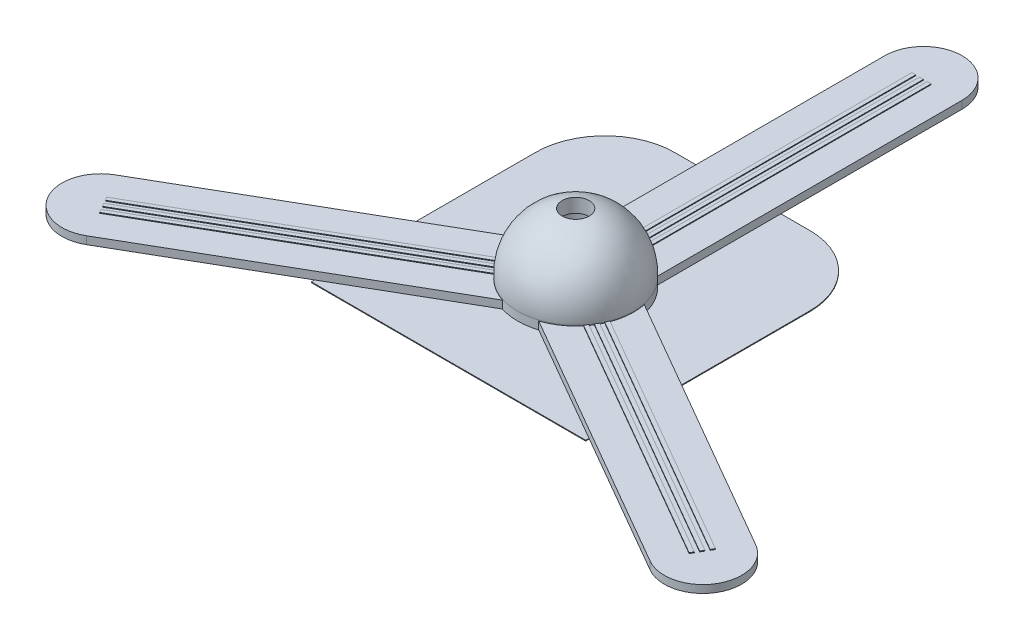
from build123d import *

# Parameters (mm, degrees)
BOSS_EXTRUDE1_DEPTH = 1
SKETCH2_R           = 7.5
BOSS_EXTRUDE2_DEPTH = 0.1
DOME1_FACE_RADIUS   = 7.5
DOME1_HEIGHT        = 8
SKETCH3_R           = 1.75
CUT_EXTRUDE1_DEPTH  = 68.203209981
SKETCH5_R           = 2.75
CUT_EXTRUDE2_DEPTH  = 7.1
SKETCH6_W           = 0.5
SKETCH6_H           = 38.067336288
BOSS_EXTRUDE3_DEPTH = 0.1
BOSS_EXTRUDE6_DEPTH = 0.1


with BuildPart() as part:
    # Sketch1 → Boss-Extrude1 (new body)
    with BuildSketch(Plane(origin=(0, 0, 0), x_dir=(1, 0, 0), z_dir=(0, 1, 0))):
        with BuildLine():
            Line((-5, 45), (-5, 5.590169944))
            ThreePointArc((-5, 5.590169944), (-6.495190528, 3.75), (-7.341229183, 1.535042047))
            Line((-7.341229183, 1.535042047), (-41.47114317, -18.169872981))
            ThreePointArc((-41.47114317, -18.169872981), (-43.301270189, -25), (-36.47114317, -26.830127019))
            Line((-36.47114317, -26.830127019), (-2.341229183, -7.125211991))
            ThreePointArc((-2.341229183, -7.125211991), (0, -7.5), (2.341229183, -7.125211991))
            Line((2.341229183, -7.125211991), (36.47114317, -26.830127019))
            ThreePointArc((36.47114317, -26.830127019), (43.301270189, -25), (41.47114317, -18.169872981))
            Line((41.47114317, -18.169872981), (7.341229183, 1.535042047))
            ThreePointArc((7.341229183, 1.535042047), (6.495190528, 3.75), (5, 5.590169944))
            Line((5, 5.590169944), (5, 45))
            ThreePointArc((5, 45), (0, 50), (-5, 45))
        make_face()
    extrude(amount=BOSS_EXTRUDE1_DEPTH)

    # Sketch2 → Boss-Extrude2 (add)
    with BuildSketch(Plane(origin=(0, 1, 0), x_dir=(1, 0, 0), z_dir=(0, 1, 0))):
        with Locations(Location((0, 0, 0), (0, 0, 48.189685104))):
            Circle(SKETCH2_R)
    extrude(amount=BOSS_EXTRUDE2_DEPTH)

    # Dome1: a dome of height H over a round flat face of radius A is a cap of a sphere of radius (A * A + H * H) / (2 * H)
    dome1_r = (DOME1_FACE_RADIUS * DOME1_FACE_RADIUS + DOME1_HEIGHT * DOME1_HEIGHT) / (2 * DOME1_HEIGHT)
    dome1_base = Plane((0, 1.1, 0), z_dir=(0, 1, 0))
    with Locations(dome1_base.offset(DOME1_HEIGHT - dome1_r)):
        dome1_ball = Sphere(dome1_r, mode=Mode.PRIVATE)
    add(split(dome1_ball, bisect_by=dome1_base, keep=Keep.TOP, mode=Mode.PRIVATE))

    # Sketch3 → Cut-Extrude1 (cut, through all)
    with BuildSketch(Plane.XZ):
        with Locations(Location((0, 0, 0), (0, 0, 270))):
            Circle(SKETCH3_R)
    extrude(amount=-CUT_EXTRUDE1_DEPTH, mode=Mode.SUBTRACT)

    # Sketch5 → Cut-Extrude2 (cut)
    with BuildSketch(Plane.XZ):
        with Locations(Location((0, 0, 0), (0, 0, 270))):
            Circle(SKETCH5_R)
    extrude(amount=-CUT_EXTRUDE2_DEPTH, mode=Mode.SUBTRACT)

    # Sketch6 → Boss-Extrude3 (add)
    with BuildSketch(Plane(origin=(0, 1, 0), x_dir=(1, 0, 0), z_dir=(0, 1, 0))):
        with Locations((-1, 25.721859363)):
            Rectangle(SKETCH6_W, SKETCH6_H)
        with Locations((0, 25.721859363)):
            Rectangle(SKETCH6_W, SKETCH6_H)
        with Locations((1, 25.721859363)):
            Rectangle(SKETCH6_W, SKETCH6_H)
        Polygon((39.384423781, -21.295231999), (6.417143501, -2.261563855), (6.167143501, -2.694576557), (39.134423781, -21.728244701), align=None)
        Polygon((38.884423781, -22.161257403), (5.917143501, -3.127589259), (5.667143501, -3.560601961), (38.634423781, -22.594270105), align=None)
        Polygon((38.384423781, -23.027282807), (5.417143501, -3.993614663), (5.167143501, -4.426627364), (38.134423781, -23.460295508), align=None)
        Polygon((-38.134423781, -23.460295508), (-5.167143501, -4.426627364), (-5.417143501, -3.993614663), (-38.384423781, -23.027282807), align=None)
        Polygon((-38.634423781, -22.594270105), (-5.667143501, -3.560601961), (-5.917143501, -3.127589259), (-38.884423781, -22.161257403), align=None)
        Polygon((-39.134423781, -21.728244701), (-6.167143501, -2.694576557), (-6.417143501, -2.261563855), (-39.384423781, -21.295231999), align=None)
    extrude(amount=BOSS_EXTRUDE3_DEPTH)

    # Sketch11 → Boss-Extrude6 (add)
    with BuildSketch(Plane.XZ):
        with BuildLine():
            Line((17.740956204, 16.443798031), (-17.759043796, 16.443798031))
            Line((-17.759043796, 16.443798031), (-17.759043796, -12.556201969))
            ThreePointArc((-17.759043796, -12.556201969), (-15.097202282, -18.94586135), (-8.686211126, -21.555907264))
            Line((-8.686211126, -21.555907264), (8.813788874, -21.555907264))
            ThreePointArc((8.813788874, -21.555907264), (15.130615586, -18.894360454), (17.740956204, -12.556201969))
            Line((17.740956204, -12.556201969), (17.740956204, 16.443798031))
        make_face()
    extrude(amount=BOSS_EXTRUDE6_DEPTH)


solid = part.part
